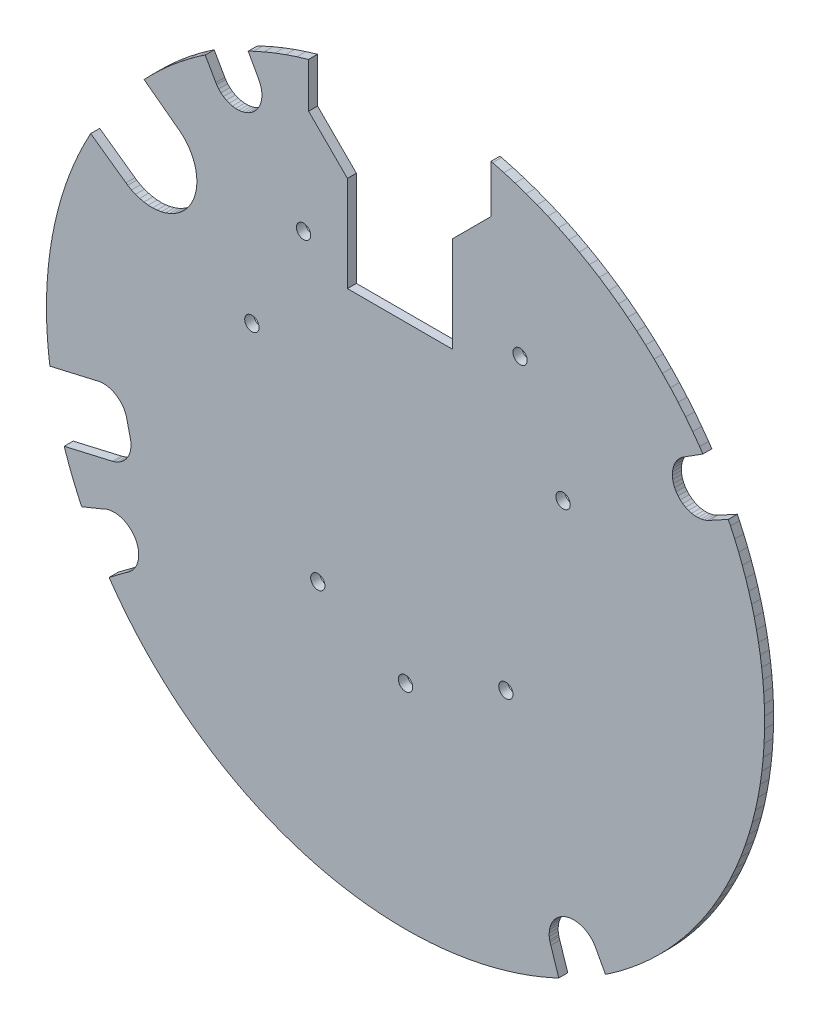
from build123d import *

# Parameters (mm, degrees)
MODEL_R             = 1.5875
MODEL_R_2           = 1.59999934
BOSS_EXTRUDE1_DEPTH = 2


with BuildPart() as part:
    # Model → Boss-Extrude1 (new body)
    with BuildSketch(Plane.XY):
        Polygon((19.04364746, 77.7128367), (19.40194494, 77.62944596), (21.91333184, 76.95824842), (24.40159204, 76.2058293), (26.86409918, 75.37298108), (29.2982523, 74.4605826), (31.701486, 73.46959906), (34.07125774, 72.4010744), (36.40507324, 71.25613384), (38.70046362, 70.0359915), (40.9550108, 68.74193008), (43.1663348, 67.37531864), (45.33209882, 65.9375999), (47.45001686, 64.4302877), (49.5178588, 62.85497462), (51.5334377, 61.21332182), (53.49462504, 59.50706666), (55.3993558, 57.73800492), (57.2456183, 55.90800604), (59.03146182, 54.01900296), (60.75500168, 52.0729845), (62.41441924, 50.0720106), (64.00796444, 48.01818692), (65.5339558, 45.91368516), (66.26035008, 44.82772086), (62.32023858, 42.32185592), (62.01041446, 42.13935438), (61.42985174, 41.71558078), (60.90958862, 41.21963308), (60.45853542, 40.6600025), (60.08440866, 40.04626992), (59.7936193, 39.38894078), (59.59114574, 38.6992749), (59.48045, 37.98907312), (59.463432, 37.2704995), (59.54037876, 36.55585526), (59.7099771, 35.85737558), (59.96932126, 35.18701878), (60.31397132, 34.55626312), (60.73802686, 33.97590614), (61.23422602, 33.45588178), (61.79407504, 33.00510036), (62.4079905, 32.63127078), (63.06545934, 32.34080146), (63.75522428, 32.13866064), (64.4654794, 32.02831034), (65.18406064, 32.01164032), (65.89866678, 32.08893506), (66.59706518, 32.25887122), (67.26729498, 32.5185405), (67.58824176, 32.6806941), (71.92344772, 35.04417172), (72.41999994, 34.02506022), (73.35496124, 31.95951952), (74.23102248, 29.86831974), (75.04748262, 27.75313474), (75.80368634, 25.61566632), (76.49902404, 23.45763152), (77.13293946, 21.28076262), (77.7049246, 19.08680714), (78.21451464, 16.8775253), (78.66130826, 14.65469256), (79.0449397, 12.420092), (79.3651067, 10.17552194), (79.62154764, 7.92277816), (79.81405932, 5.66367422), (79.9424868, 3.40002368), (80.00672594, 1.13364264), (80.00672594, -2.54e-06), (80.00672848, -1.4004036), (79.90870988, -4.19948868), (79.7127946, -6.9934328), (79.41921886, -9.77880696), (79.02834842, -12.55219994), (78.54065826, -15.31021576), (77.95674528, -18.04947622), (77.27732576, -20.76662344), (76.50323282, -23.45832748), (75.63541388, -26.12129396), (74.67493066, -28.75225644), (73.62296426, -31.34799674), (72.48079992, -33.9053297), (71.24983718, -36.42112604), (69.9315848, -38.89229966), (68.52765822, -41.31582796), (67.03977702, -43.68873914), (65.46976492, -46.0081249), (63.81954216, -48.27114806), (62.09113566, -50.47502986), (60.2866587, -52.61707536), (58.40832362, -54.6946582), (56.45842912, -56.7052333), (54.43936788, -58.6463394), (52.35361132, -60.51559398), (50.20371722, -62.31071104), (47.99231448, -64.02949094), (45.72211836, -65.66982548), (44.54934194, -66.44737282), (42.33415968, -62.34291062), (42.1670099, -62.05450886), (41.78183668, -61.51073804), (41.33365622, -61.01760466), (40.82906236, -60.5823655), (40.27548206, -60.21142644), (39.6810611, -59.91024594), (39.0545447, -59.6832563), (38.40515306, -59.53379762), (37.7424442, -59.464067), (37.07616664, -59.47509314), (36.41612732, -59.56671348), (35.77203666, -59.73757928), (35.15337394, -59.98517594), (34.56924506, -60.30585856), (34.0282403, -60.69491036), (33.5383251, -61.14660618), (33.10670798, -61.65430138), (32.73973894, -62.21052074), (32.44281802, -62.80708038), (32.22031402, -63.4352046), (32.07550354, -64.0856478), (32.0105151, -64.74883926), (32.02630628, -65.4150203), (32.1226434, -66.07438906), (32.2006214, -66.39847528), (32.37638432, -66.9330132), (34.151824, -72.35143264), (32.874331, -72.95444642), (30.27835956, -74.06951912), (27.64464118, -75.09225266), (24.97646008, -76.0213745), (22.27714112, -76.85572132), (19.5500498, -77.59425426), (16.79858718, -78.23605384), (14.02618226, -78.7803225), (11.23628944, -79.22637444), (8.43239106, -79.57366102), (5.61797962, -79.82174536), (2.7965654, -79.97032012), (-0.02833624, -80.0191948), (-2.85320232, -79.9683186), (-5.6745124, -79.8177474), (-8.48874604, -79.56766916), (-11.29239804, -79.21839884), (-14.08197336, -78.77036824), (-16.8539922, -78.2241387), (-19.60500016, -77.5803884), (-22.33156824, -76.83992506), (-25.03029538, -76.00366562), (-27.69781862, -75.07265656), (-30.33081056, -74.04805612), (-32.92599206, -72.93114446), (-35.48012462, -71.7233135), (-37.99002816, -70.42606438), (-40.45256832, -69.04102016), (-42.86467932, -67.5699055), (-45.22335126, -66.01455428), (-47.52564536, -64.37690452), (-49.76869142, -62.65899838), (-51.9496929, -60.86297708), (-54.065932, -58.99108344), (-56.11476712, -57.0456441), (-58.0936481, -55.02908984), (-60.00010606, -52.94393526), (-61.83176356, -50.7927737), (-63.58633714, -48.57829248), (-65.26163986, -46.30325258), (-66.05861312, -45.1368668), (-62.23830326, -42.2762299), (-61.9297466, -42.0872158), (-61.3532555, -41.65038406), (-60.83915188, -41.1415992), (-60.39635368, -40.56967756), (-60.03253424, -39.94453784), (-59.75400292, -39.27701568), (-59.56558826, -38.57868586), (-59.47055924, -37.86165402), (-59.45864156, -37.50000374), (-59.4703281, -37.14184342), (-59.56353594, -36.43161624), (-59.7483692, -35.73955514), (-60.02168082, -35.07743048), (-60.37882768, -34.456497), (-60.8137341, -33.88731602), (-61.3190036, -33.37956494), (-61.88604844, -32.94187722), (-62.50522678, -32.58169506), (-63.16600524, -32.30514494), (-63.85715194, -32.11692586), (-64.5669143, -32.02024076), (-65.28322224, -32.01673556), (-65.993899, -32.1064636), (-66.68685418, -32.28790596), (-67.35031234, -32.55797146), (-67.6683559, -32.72530158), (-72.15960168, -34.55530554), (-72.77527228, -33.26964136), (-73.91423368, -30.65608296), (-74.95937002, -28.00360922), (-75.90935542, -25.31558818), (-76.06040922, -24.8342404), (-65.33552338, -22.35820776), (-64.99424644, -22.27941442), (-64.33808062, -22.03408598), (-63.71955252, -21.70520678), (-63.14924124, -21.298408), (-62.63690546, -20.82064924), (-62.1913158, -20.28010422), (-61.82009226, -19.68602362), (-61.52958738, -19.04856998), (-61.32477448, -18.37865006), (-61.20915368, -17.68772942), (-61.18470618, -16.98762922), (-61.25184854, -16.29032556), (-61.33063934, -15.94903846), (-62.1260632, -12.50366054), (-62.20486162, -12.1623836), (-62.45019006, -11.50621524), (-62.77906926, -10.8876846), (-63.1858655, -10.31737332), (-63.66362426, -9.80504008), (-64.20416928, -9.35944788), (-64.79824988, -8.98822434), (-65.43570352, -8.69771946), (-66.10562344, -8.49290402), (-66.79654408, -8.37728322), (-67.49664428, -8.35283572), (-68.19394794, -8.41997808), (-68.53523504, -8.49876888), (-79.25604672, -10.97386426), (-79.55219548, -8.6346665), (-79.80929428, -5.79533258), (-79.96508518, -2.94864028), (-80.01936752, -0.09820656), (-79.97208034, 2.75235416), (-79.82327698, 5.59941984), (-79.57314794, 8.4393786), (-79.22201326, 11.26862364), (-78.7703149, 14.0835634), (-78.2186269, 16.88062664), (-77.5676503, 19.65626244), (-76.8182106, 22.40694782), (-75.97126284, 25.12919028), (-75.0278789, 27.81953542), (-73.98925512, 30.4745644), (-72.8567123, 33.09091172), (-71.63168554, 35.66525506), (-70.3157344, 38.1943229), (-70.1599943, 38.46924742), (-62.31042148, 32.88710974), (-61.9131096, 32.60456522), (-61.06728706, 32.1194557), (-60.17828706, 31.7189231), (-59.2545424, 31.40676472), (-58.30481354, 31.18594728), (-57.33810732, 31.0585612), (-56.36359314, 31.02581552), (-55.39051914, 31.08802266), (-54.42810806, 31.24458826), (-53.4854912, 31.4940315), (-52.57160936, 31.8339851), (-51.69513156, 32.26122326), (-50.86436868, 32.77169468), (-50.08720234, 33.36055812), (-49.37100362, 34.02222812), (-48.72256702, 34.75042834), (-48.14803934, 35.53825252), (-47.65287142, 36.37822544), (-47.24176226, 37.2623842), (-46.91860822, 38.18233918), (-46.68647508, 39.12936802), (-46.54756756, 40.0944842), (-46.50319884, 41.06853864), (-46.55379056, 42.04228574), (-46.6988652, 43.00649768), (-46.93704354, 43.95202284), (-47.26607006, 44.86989502), (-47.6828231, 45.7514071), (-48.18334788, 46.58819994), (-48.76289714, 47.37233604), (-49.41597686, 48.09637574), (-50.13638944, 48.75345596), (-50.52684586, 49.04539848), (-58.26391954, 54.83609556), (-56.7383803, 56.42574694), (-54.69233664, 58.41110238), (-52.5768697, 60.32231268), (-50.39466172, 62.1569496), (-48.14848638, 63.91268904), (-45.84119102, 65.58729834), (-44.64884898, 66.380741), (-42.26677856, 62.22172976), (-42.07774414, 61.91542354), (-41.6416109, 61.34318186), (-41.13442878, 60.8328476), (-40.56489982, 60.39317868), (-39.94279286, 60.03171636), (-39.27878098, 59.75466078), (-38.58425354, 59.56676428), (-37.87112568, 59.47125266), (-37.15163258, 59.46976168), (-36.4381161, 59.56232182), (-35.7428165, 59.74733796), (-35.07766162, 60.02164272), (-34.45406114, 60.3805244), (-33.88271608, 60.81783112), (-33.37342576, 61.32605972), (-32.93492778, 61.89649292), (-32.57474308, 62.51933902), (-32.29905148, 63.18391986), (-32.11258246, 63.87883338), (-32.01853642, 64.59215428), (-32.00673812, 64.9519021), (-32.0176271, 65.29763928), (-32.10449256, 65.98363232), (-32.27685188, 66.65327792), (-32.53196948, 67.2959665), (-32.68934788, 67.60399992), (-35.05867766, 71.91638144), (-33.8903437, 72.4859358), (-31.51791004, 73.54853972), (-29.11221, 74.5335187), (-26.67578612, 75.43983388), (-24.21120634, 76.26653022), (-21.72107416, 77.01273396), (-21.59635254, 77.04573364), (-21.59635, 67.0536505), (-12.96035, 58.4176505), (-12.95035256, 58.4176505), (-12.95035002, 37.15114998), (10.41764998, 37.15114998), (10.41764998, 58.42765048), (19.04365, 67.0536505), align=None)
        with Locations((25.5310005, 43.3110005)):
            Circle(MODEL_R, mode=Mode.SUBTRACT)
        with Locations((-22.7289995, 43.3110005)):
            Circle(MODEL_R, mode=Mode.SUBTRACT)
        with Locations((22.3560005, -22.7289995)):
            Circle(MODEL_R, mode=Mode.SUBTRACT)
        with Locations((-19.5539995, -22.7289995)):
            Circle(MODEL_R, mode=Mode.SUBTRACT)
        with Locations((35.10868772, 20.27001026)):
            Circle(MODEL_R_2, mode=Mode.SUBTRACT)
        with Locations((0, -32.5400162)):
            Circle(MODEL_R_2, mode=Mode.SUBTRACT)
        with Locations((-34.24266202, 19.77001126)):
            Circle(MODEL_R_2, mode=Mode.SUBTRACT)
    extrude(amount=BOSS_EXTRUDE1_DEPTH)


solid = part.part
